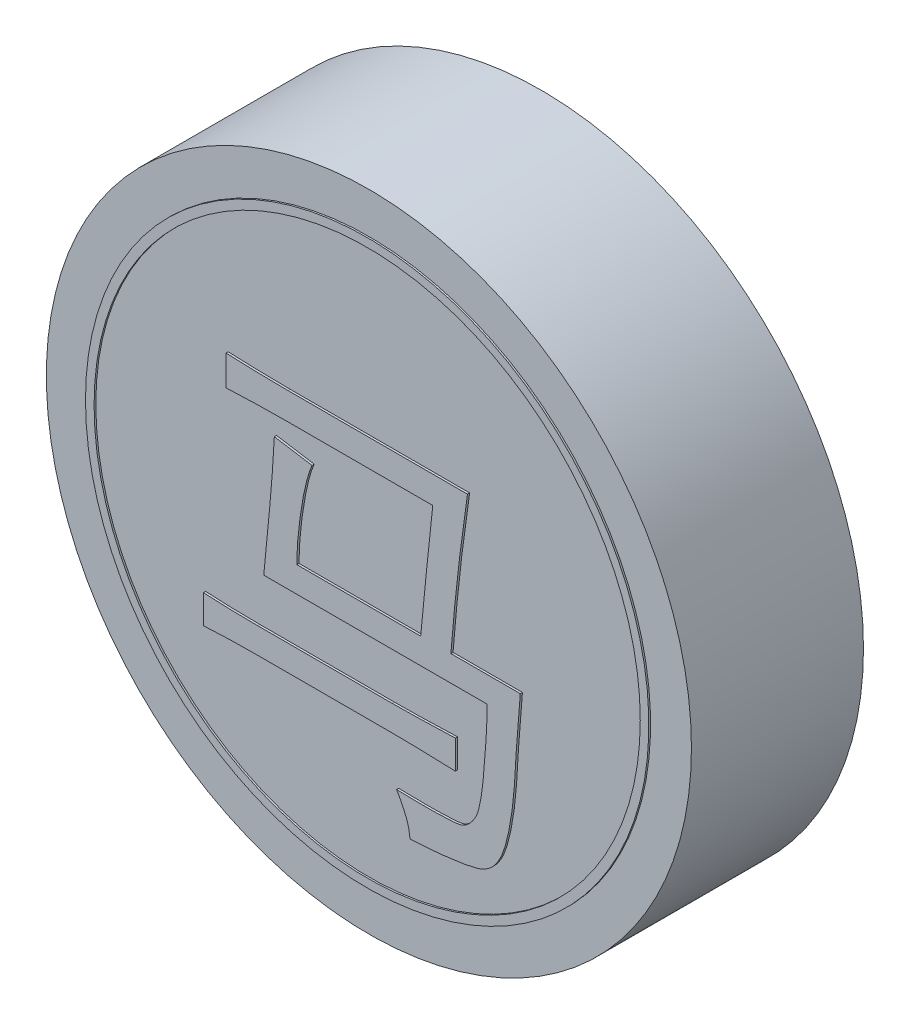
from build123d import *

# Parameters (mm, degrees)
SKETCH_1_R               = 15
DIAMETER30_HEIGHT8_DEPTH = 8
CHARACTER_DEPTH          = 0.1
SKETCH_3_R               = 13.1
SKETCH_3_R_2             = 12.7
INK_RING_DEPTH           = 0.08


with BuildPart() as part:
    # 草图1 → Diameter30_Height8 (new body)
    with BuildSketch(Plane.XY):
        Circle(SKETCH_1_R)
    extrude(amount=-DIAMETER30_HEIGHT8_DEPTH)

    # 草图2 → Character_马 (add)
    with BuildSketch(Plane.XY):
        with BuildLine():
            add(Edge.make_bspline(
                [(-2.543859649, 2.657894737), (-2.568109523, 2.601908638), (-2.618944351, 2.484545403), (-2.68091831, 2.29374228), (-2.747882739, 2.084905171), (-2.809197893, 1.853949883), (-2.867938942, 1.601351852), (-2.929388828, 1.329074257), (-2.981674213, 1.034530608), (-3.05538164, 0.620649676), (-3.127595616, 0.098084884), (-3.197623224, -0.517816396), (-3.237414282, -1.112851594), (-3.242919292, -1.502329954), (-3.245614035, -1.692982456)],
                knots=[0, 0, 0, 0, 0.495689669, 1.0391105, 1.629386371, 2.27856569, 2.980637221, 3.737641002, 4.547078417, 5.411969332, 7.15491927, 8.834024839, 10.450232028, 12, 12, 12, 12], degree=3))
            Line((-3.245614035, -1.692982456), (2.50877193, -1.692982456))
            add(Edge.make_bspline(
                [(2.50877193, -1.692982456), (2.555842668, -1.219109546), (2.651092154, -0.26020911), (2.765765857, 0.939059138), (2.857689962, 1.892225125), (2.928191701, 2.576627854), (2.997770846, 3.225611417), (3.046502797, 3.646446892), (3.070175439, 3.850877193)],
                knots=[0, 0, 0, 0, 1.538264342, 3.112738277, 3.891618687, 4.631513556, 5.335226919, 6, 6, 6, 6], degree=3))
            Line((3.070175439, 3.850877193), (-3.666666667, 3.850877193))
            add(Edge.make_bspline(
                [(-3.666666667, 3.850877193), (-3.893660384, 3.849684604), (-4.355478431, 3.847258285), (-5.06158577, 3.833290973), (-5.793776141, 3.813732), (-6.290908298, 3.791840575), (-6.543859649, 3.780701754)],
                knots=[0, 0, 0, 0, 0.946376728, 1.925400653, 2.944399995, 4, 4, 4, 4], degree=3))
            Line((-6.543859649, 3.780701754), (-6.543859649, 5.184210526))
            add(Edge.make_bspline(
                [(-6.543859649, 5.184210526), (-6.290908298, 5.173071706), (-5.793776141, 5.15118028), (-5.06158577, 5.131621308), (-4.355478431, 5.117653996), (-3.893660384, 5.115227677), (-3.666666667, 5.114035088)],
                knots=[0, 0, 0, 0, 1.055600005, 2.074599347, 3.053623272, 4, 4, 4, 4], degree=3))
            Line((-3.666666667, 5.114035088), (4.684210526, 5.114035088))
            add(Edge.make_bspline(
                [(4.684210526, 5.114035088), (4.594389665, 4.480170947), (4.4139847, 3.207056477), (4.243054526, 1.774416685), (4.14478495, 0.828967937), (4.097381465, 0.388144624), (4.055421695, -0.025950303), (4.020061293, -0.412530658), (3.985399458, -0.77104386), (3.956533585, -1.101987754), (3.933708028, -1.406199086), (3.919206962, -1.600281379), (3.912280702, -1.692982456)],
                knots=[0, 0, 0, 0, 2.802935976, 5.629689589, 6.316260642, 6.964711014, 7.570877404, 8.13855511, 8.664335647, 9.147876972, 9.592993668, 10, 10, 10, 10], degree=3))
            Line((3.912280702, -1.692982456), (7.140350877, -1.692982456))
            add(Edge.make_bspline(
                [(7.140350877, -1.692982456), (7.117496771, -1.957195671), (7.070752869, -2.497595555), (7.005207646, -3.329223298), (6.94597212, -4.200007765), (6.901683429, -4.946124678), (6.868307152, -5.546229635), (6.826684596, -5.980862849), (6.785382047, -6.39647152), (6.728695376, -6.792040318), (6.670245675, -7.168463089), (6.603590191, -7.526033406), (6.524025139, -7.862448123), (6.444320105, -8.179786345), (6.348007699, -8.470700422), (6.240664659, -8.735979197), (6.112879912, -8.969541099), (5.972363355, -9.176368475), (5.813514, -9.350805736), (5.639780874, -9.496502029), (5.450674708, -9.612389616), (5.239809272, -9.700393942), (4.996758723, -9.765827824), (4.713795659, -9.832208089), (4.381558555, -9.885783366), (4.002176073, -9.941267696), (3.574948301, -9.992657478), (3.098313267, -10.039000074), (2.574062445, -10.080415008), (2.208184758, -10.1025182), (2.01754386, -10.114035088)],
                knots=[0, 0, 0, 0, 1.887044686, 3.859605311, 5.935782741, 8.09729868, 9.178245636, 10.211890598, 11.203790184, 12.149721099, 13.054774096, 13.914409008, 14.736879022, 15.514410289, 16.241554355, 16.915874949, 17.547596075, 18.132428342, 18.691003543, 19.220627564, 19.740803274, 20.262911441, 20.840419939, 21.529816771, 22.330465222, 23.233668769, 24.258284961, 25.391864306, 26.641028549, 28, 28, 28, 28], degree=3))
            add(Edge.make_bspline(
                [(2.01754386, -10.114035088), (1.999634211, -9.981554353), (1.962380573, -9.705982807), (1.828075725, -9.291338106), (1.637078715, -8.859880402), (1.472081327, -8.577306965), (1.385964912, -8.429824561)],
                knots=[0, 0, 0, 0, 0.882983811, 1.83668375, 2.870909156, 4, 4, 4, 4], degree=3))
            add(Edge.make_bspline(
                [(1.385964912, -8.429824561), (1.601684871, -8.434299725), (2.00798008, -8.44272842), (2.580650352, -8.452457271), (3.078902343, -8.449896251), (3.50262546, -8.439476904), (3.851072115, -8.425325844), (4.125715661, -8.404487351), (4.325845969, -8.373466937), (4.498441923, -8.324930212), (4.647964297, -8.219854178), (4.806608465, -8.080366), (4.946574967, -7.900402806), (5.057213348, -7.72659571), (5.135709742, -7.551771137), (5.19099419, -7.380870408), (5.241966461, -7.171945715), (5.293801136, -6.927772939), (5.340465741, -6.64505285), (5.379651802, -6.325610866), (5.42315596, -5.969892033), (5.467875091, -5.457573461), (5.519200344, -4.8262348), (5.563244909, -4.113096685), (5.591709685, -3.474461181), (5.594963512, -3.073991037), (5.596491228, -2.885964912)],
                knots=[0, 0, 0, 0, 1.758141494, 3.31135083, 4.666771348, 5.817797705, 6.764703246, 7.508656711, 8.059921999, 8.414932624, 8.957450007, 9.527295967, 10.134772448, 10.806750365, 11.201697625, 11.692819884, 12.268105713, 12.953448137, 13.726378385, 14.601998413, 15.575707604, 16.646246692, 18.791940105, 20.736977137, 22.467966827, 24, 24, 24, 24], degree=3))
            Line((5.596491228, -2.885964912), (-4.789473684, -2.885964912))
            add(Edge.make_bspline(
                [(-4.789473684, -2.885964912), (-4.742500482, -2.409482331), (-4.646861986, -1.439353083), (-4.506084048, 0.025074391), (-4.381186338, 1.489718928), (-4.325531367, 2.461946264), (-4.298245614, 2.938596491)],
                knots=[0, 0, 0, 0, 0.982838397, 2.001081075, 3.019997563, 4, 4, 4, 4], degree=3))
            add(Edge.make_bspline(
                [(-4.298245614, 2.938596491), (-4.000143593, 2.892268938), (-3.414928922, 2.801321673), (-2.830558232, 2.705101429), (-2.543859649, 2.657894737)],
                knots=[0, 0, 0, 0, 1.018778359, 2, 2, 2, 2], degree=3))
        make_face()
        with BuildLine():
            add(Edge.make_bspline(
                [(1.175438596, -5.061403509), (1.272474939, -5.06183074), (1.474359506, -5.062719598), (1.787949201, -5.055481089), (2.124128563, -5.051460824), (2.48108109, -5.043574331), (2.860490404, -5.031942174), (3.261734399, -5.023647615), (3.685265265, -5.005984943), (3.974652272, -4.996224852), (4.122807018, -4.99122807)],
                knots=[0, 0, 0, 0, 0.789853886, 1.643294733, 2.553146486, 3.526589248, 4.549556957, 5.643022245, 6.793320254, 8, 8, 8, 8], degree=3))
            Line((4.122807018, -4.99122807), (4.122807018, -6.324561404))
            add(Edge.make_bspline(
                [(4.122807018, -6.324561404), (3.969453719, -6.319579397), (3.671400907, -6.309896522), (3.237471852, -6.292228161), (2.829302521, -6.283816356), (2.447289567, -6.272341119), (2.09207297, -6.264362463), (1.762823851, -6.260344735), (1.460498309, -6.253100348), (1.267276772, -6.253971776), (1.175438596, -6.254385965)],
                knots=[0, 0, 0, 0, 1.248975298, 2.427470434, 3.535041912, 4.572114753, 5.538512415, 6.427215019, 7.252455469, 8, 8, 8, 8], degree=3))
            Line((1.175438596, -6.254385965), (-5.070175439, -6.254385965))
            add(Edge.make_bspline(
                [(-5.070175439, -6.254385965), (-5.298037146, -6.255493864), (-5.742534486, -6.257655079), (-6.391477007, -6.271227092), (-7.005930309, -6.290151347), (-7.403331701, -6.313306629), (-7.596491228, -6.324561404)],
                knots=[0, 0, 0, 0, 1.081761786, 2.110228356, 3.081464224, 4, 4, 4, 4], degree=3))
            Line((-7.596491228, -6.324561404), (-7.596491228, -4.99122807))
            add(Edge.make_bspline(
                [(-7.596491228, -4.99122807), (-7.403331701, -5.002482845), (-7.005930309, -5.025638127), (-6.391477007, -5.044562382), (-5.742534486, -5.058134395), (-5.298037146, -5.06029561), (-5.070175439, -5.061403509)],
                knots=[0, 0, 0, 0, 0.918535776, 1.889771644, 2.918238214, 4, 4, 4, 4], degree=3))
            Line((-5.070175439, -5.061403509), (1.175438596, -5.061403509))
        make_face()
    extrude(amount=CHARACTER_DEPTH)

    # 草图3 → Ink_ring (add)
    with BuildSketch(Plane.XY):
        with Locations(Location((0, 0, 0), (0, 0, 180))):
            Circle(SKETCH_3_R)
        with Locations(Location((0, 0, 0), (0, 0, 180))):
            Circle(SKETCH_3_R_2, mode=Mode.SUBTRACT)
    extrude(amount=INK_RING_DEPTH)


solid = part.part
